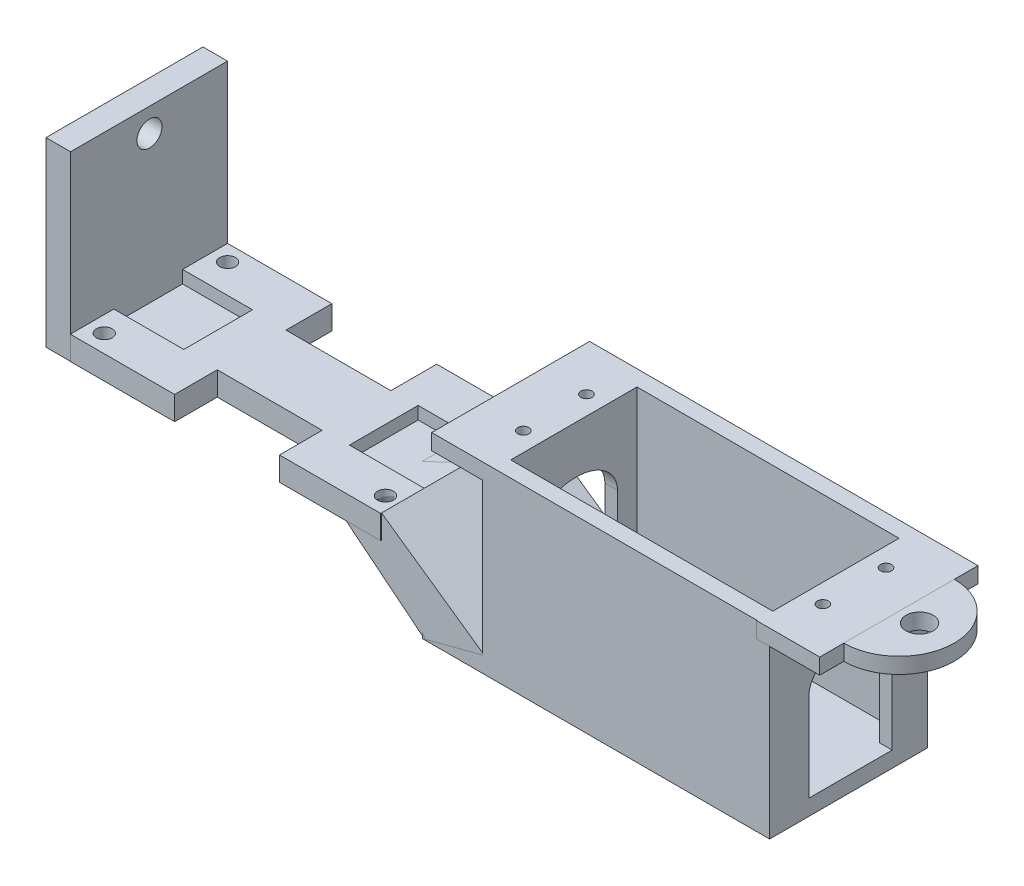
from build123d import *

# Parameters (mm, degrees)
SKETCH2_W                = 46.228
SKETCH2_H                = 25.4
SKETCH2_W_2              = 42.164
SKETCH2_H_2              = 20.32
BOSS_EXTRUDE1_DEPTH      = 26.924
CUT_EXTRUDE2_DEPTH       = 57.27570692
SKETCH7_W                = 10.16
SKETCH7_H                = 25.468917493
SKETCH7_R                = 0.889
SKETCH7_H_2              = 25.4
BOSS_EXTRUDE2_DEPTH      = 2.54
SKETCH8_W                = 55.88
SKETCH8_H                = 25.4
BOSS_EXTRUDE3_DEPTH      = 2.54
SKETCH9_W                = 49.9364
SKETCH9_H                = 25.295126645
BOSS_EXTRUDE4_DEPTH      = 3.81
BOSS_EXTRUDE6_DEPTH      = 25.164887468
SKETCH13_R               = 1.27
SKETCH13_R_2             = 1.269999999
CUT_EXTRUDE3_DEPTH       = 97.850165524
BOSS_EXTRUDE7_DEPTH      = 25.4
BOSS_EXTRUDE7_DEPTH_BACK = 3.81
SKETCH14_W               = 3.949525569
SKETCH14_H               = 25.258159439
SKETCH15_R               = 2.014878308
CUT_EXTRUDE4_DEPTH       = 25.4
SKETCH16_W               = 16.869515363
SKETCH16_H               = 7.378931384
SKETCH16_H_2             = 6.858865863
CUT_EXTRUDE5_DEPTH       = 25.4
SKETCH17_W               = 12.031127212
SKETCH17_H               = 11.057329398
SKETCH17_W_2             = 11.254273727
CUT_EXTRUDE6_DEPTH       = 2.032
SKETCH18_R               = 2.1844
BOSS_EXTRUDE8_DEPTH      = 3.81
SKETCH19_R               = 2.1844
BOSS_EXTRUDE9_DEPTH      = 2.54


with BuildPart() as part:
    # Sketch2 → Boss-Extrude1 (new body)
    with BuildSketch(Plane(origin=(0, 0, 0), x_dir=(1, 0, 0), z_dir=(0, 1, 0))):
        with Locations((-4.777236152, 4.764977222)):
            Rectangle(SKETCH2_W, SKETCH2_H)
        with Locations((-4.777236152, 4.764977222)):
            Rectangle(SKETCH2_W_2, SKETCH2_H_2, mode=Mode.SUBTRACT)
    extrude(amount=-BOSS_EXTRUDE1_DEPTH)

    # Sketch6 → Cut-Extrude2 (cut, through all)
    with BuildSketch(Plane.ZY.offset(27.891236152)):
        with BuildLine():
            Line((-11.782176259, -26.924), (1.631916928, -26.924))
            Line((1.631916928, -26.924), (1.631916928, -12.829472687))
            add(Edge.make_bspline(
                [(1.631916928, -12.829472687), (1.631916928, -7.653676396), (-5.075129666, -7.653676396), (-11.782176259, -7.653676396), (-11.782176259, -12.829472687)],
                knots=[3.141592654, 3.141592654, 3.141592654, 4.71238898, 4.71238898, 6.283185307, 6.283185307, 6.283185307], degree=2, weights=[1, 0.707106781, 1, 0.707106781, 1]))
            Line((-11.782176259, -12.829472687), (-11.782176259, -26.924))
        make_face()
    extrude(amount=-CUT_EXTRUDE2_DEPTH, mode=Mode.SUBTRACT)

    # Sketch7 → Boss-Extrude2 (add)
    # profile 1 of 2: a face of its own
    with BuildSketch(Plane(origin=(0, 0, 0), x_dir=(1, 0, 0), z_dir=(0, 1, 0))):
        with Locations((21.384763848, 4.730518476)):
            Rectangle(SKETCH7_W, SKETCH7_H)
        with Locations(Location((19.352763848, 9.776059729, 0), (0, 0, 270))):
            Circle(SKETCH7_R, mode=Mode.SUBTRACT)
        with Locations(Location((19.352763848, -0.383940271, 0), (0, 0, 270))):
            Circle(SKETCH7_R, mode=Mode.SUBTRACT)
    # profile 2 of 2: a face of its own
    with BuildSketch(Plane(origin=(0, 0, 0), x_dir=(1, 0, 0), z_dir=(0, 1, 0))):
        with Locations((-30.939236152, 4.764977222)):
            Rectangle(SKETCH7_W, SKETCH7_H_2)
        with Locations(Location((-28.907236152, -0.315022778, 0), (0, 0, 270))):
            Circle(SKETCH7_R, mode=Mode.SUBTRACT)
        with Locations(Location((-28.907236152, 9.844977222, 0), (0, 0, 270))):
            Circle(SKETCH7_R, mode=Mode.SUBTRACT)
    extrude(amount=-BOSS_EXTRUDE2_DEPTH)

    # Sketch8 → Boss-Extrude3 (add)
    with BuildSketch(Plane.XZ.offset(26.924)):
        with Locations((-9.603236152, -4.764977222)):
            Rectangle(SKETCH8_W, SKETCH8_H)
    extrude(amount=BOSS_EXTRUDE3_DEPTH)


with BuildPart() as body_2:
    # Sketch9 → Boss-Extrude4 (new body)
    with BuildSketch(Plane(origin=(0, -15.24, 0), x_dir=(1, 0, 0), z_dir=(0, 1, 0))):
        with Locations((-69.067280145, 4.582301368)):
            Rectangle(SKETCH9_W, SKETCH9_H)
    extrude(amount=-BOSS_EXTRUDE4_DEPTH)


with BuildPart() as body_3:
    # Sketch11 → Boss-Extrude6 (new body)
    with BuildSketch(Plane.XY.offset(7.935022778)):
        Polygon((-44.099080145, -15.24), (-27.383236152, -26.924), (-37.035236152, -29.464), (-51.530261874, -17.78), align=None)
    extrude(amount=-BOSS_EXTRUDE6_DEPTH)


with BuildPart() as cut_extrude3_tool:
    # Sketch13 → Cut-Extrude3 (new, through all)
    with BuildSketch(Plane(origin=(0, -15.24, 0), x_dir=(1, 0, 0), z_dir=(0, 1, 0))):
        with Locations(Location((-91.428192435, 14.630489934, 0), (0, 0, 270))):
            Circle(SKETCH13_R)
        with Locations((-46.184442435, -5.213260066)):
            Circle(SKETCH13_R)
        with Locations((-46.184442435, 14.630489934)):
            Circle(SKETCH13_R_2)
        with Locations(Location((-91.428192435, -5.213260066, 0), (0, 0, 270))):
            Circle(SKETCH13_R)
    extrude(amount=-CUT_EXTRUDE3_DEPTH)


with BuildPart() as body_2_1:
    add(body_2.part)

    # Cut-Extrude3: cut by cut_extrude3_tool
    add(cut_extrude3_tool.part, mode=Mode.SUBTRACT)

    # Sketch14 → Boss-Extrude7 (add, two sides: drawn at the far end of the back side and taken through both)
    with BuildSketch(Plane(origin=(0, -15.24, 0), x_dir=(1, 0, 0), z_dir=(0, 1, 0)).offset(-BOSS_EXTRUDE7_DEPTH_BACK)):
        with Locations((-96.01024293, 4.600784971)):
            Rectangle(SKETCH14_W, SKETCH14_H)
    extrude(amount=BOSS_EXTRUDE7_DEPTH + BOSS_EXTRUDE7_DEPTH_BACK)

    # Sketch15 → Cut-Extrude4 (cut)
    with BuildSketch(Plane(origin=(-94.035480145, 0, 0), x_dir=(0, 0, -1), z_dir=(1, 0, 0))):
        with Locations((4.671705252, 6.35)):
            Circle(SKETCH15_R)
    extrude(amount=-CUT_EXTRUDE4_DEPTH, mode=Mode.SUBTRACT)

    # Sketch16 → Cut-Extrude5 (cut)
    with BuildSketch(Plane(origin=(0, -15.24, 0), x_dir=(1, 0, 0), z_dir=(0, 1, 0))):
        with Locations((-68.817784038, 13.540398999)):
            Rectangle(SKETCH16_W, SKETCH16_H)
        with Locations((-68.817784038, -4.635829023)):
            Rectangle(SKETCH16_W, SKETCH16_H_2)
    extrude(amount=-CUT_EXTRUDE5_DEPTH, mode=Mode.SUBTRACT)


with BuildPart() as body_3_1:
    add(body_3.part)

    # Cut-Extrude3: cut by cut_extrude3_tool
    add(cut_extrude3_tool.part, mode=Mode.SUBTRACT)


with BuildPart() as cut_extrude6_tool:
    # Sketch17 → Cut-Extrude6 (new body)
    with BuildSketch(Plane(origin=(0, -15.24, 0), x_dir=(1, 0, 0), z_dir=(0, 1, 0))):
        with Locations((-50.114643751, 4.464029241)):
            Rectangle(SKETCH17_W, SKETCH17_H)
        with Locations((-88.408343282, 4.464029241)):
            Rectangle(SKETCH17_W_2, SKETCH17_H)
    extrude(amount=-CUT_EXTRUDE6_DEPTH)


with BuildPart() as body_2_2:
    add(body_2_1.part)

    # Cut-Extrude6: cut by cut_extrude6_tool
    add(cut_extrude6_tool.part, mode=Mode.SUBTRACT)

    # Sketch18 → Boss-Extrude8 (add)
    with BuildSketch(Plane(origin=(0, -2.54, 0), x_dir=(-1, 0, 0), z_dir=(0, -1, 0))):
        with BuildLine():
            Line((97.949078108, 13.419864691), (97.949078108, -4.360135309))
            ThreePointArc((97.949078108, -4.360135309), (106.839078108, 4.529864691), (97.949078108, 13.419864691))
        make_face()
        with Locations(Location((101.287005714, 4.529864691, 0), (0, 0, 90))):
            Circle(SKETCH18_R, mode=Mode.SUBTRACT)
    extrude(amount=-BOSS_EXTRUDE8_DEPTH)


with BuildPart() as body_3_2:
    add(body_3_1.part)

    # Cut-Extrude6: cut by cut_extrude6_tool
    add(cut_extrude6_tool.part, mode=Mode.SUBTRACT)


with BuildPart() as body_4:
    # Sketch19 → Boss-Extrude9 (new body)
    with BuildSketch(Plane(origin=(0, -2.54, 0), x_dir=(-1, 0, 0), z_dir=(0, -1, 0))):
        with BuildLine():
            Line((-26.464763848, 13.654977222), (-26.464763848, -4.125022778))
            ThreePointArc((-26.464763848, -4.125022778), (-35.354763848, 4.764977222), (-26.464763848, 13.654977222))
        make_face()
        with Locations(Location((-29.766763848, 4.764977222, 0), (0, 0, 90))):
            Circle(SKETCH19_R, mode=Mode.SUBTRACT)
    extrude(amount=-BOSS_EXTRUDE9_DEPTH)


solid = Compound([part.part, body_2_2.part, body_3_2.part, body_4.part])
